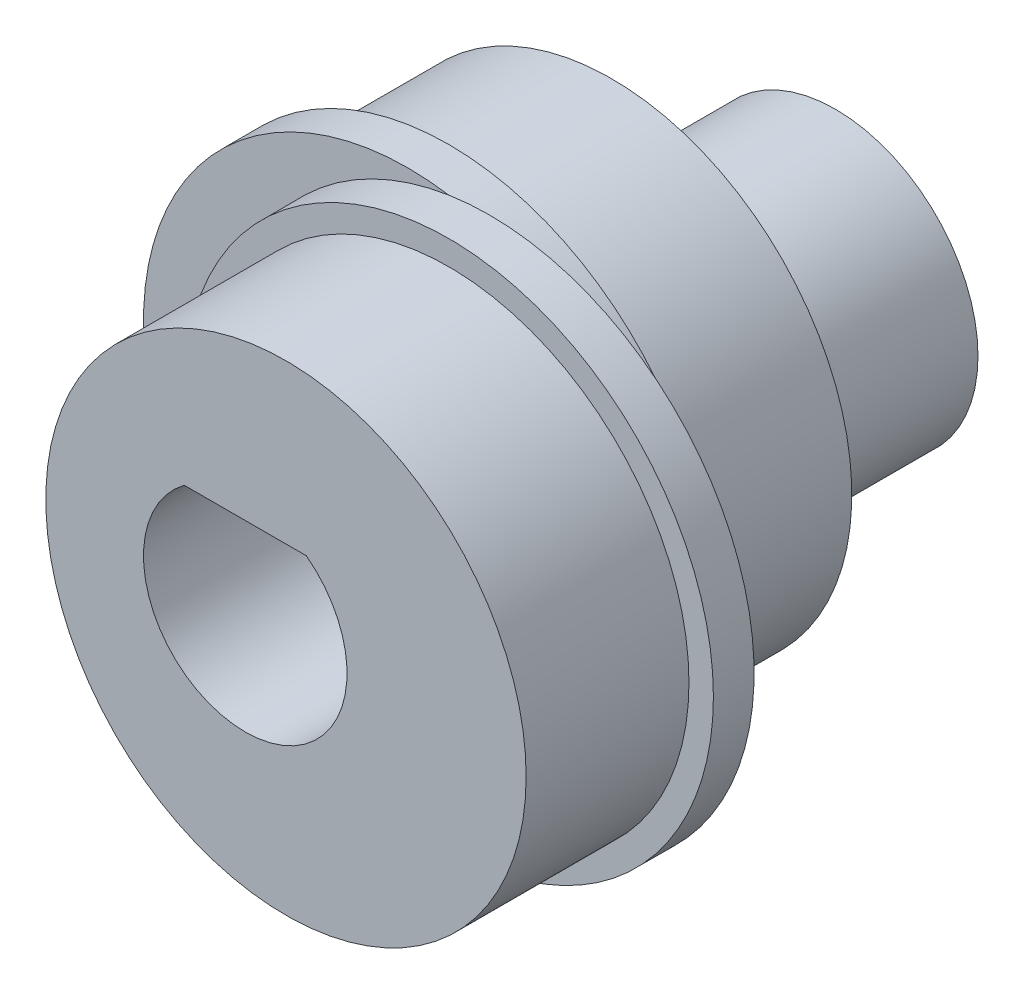
from build123d import *

# Parameters (mm, degrees)
SKETCH1_R           = 3.5
BOSS_EXTRUDE1_DEPTH = 10
SKETCH2_R           = 5.9
SKETCH2_R_2         = 3.5
BOSS_EXTRUDE2_DEPTH = 4
SKETCH3_R           = 6.5
BOSS_EXTRUDE3_DEPTH = 1
SKETCH4_R           = 6.5
BOSS_EXTRUDE4_DEPTH = 1
SKETCH5_R           = 5.9
BOSS_EXTRUDE5_DEPTH = 4
BOSS_EXTRUDE6_START = -4.5
SKETCH1_2_R         = 3.5
BOSS_EXTRUDE6_DEPTH = 4.5


with BuildPart() as part:
    # Sketch1 → Boss-Extrude1 (new body)
    with BuildSketch(Plane.XY):
        Circle(SKETCH1_R)
        with BuildLine():
            Line((-1.5, 2), (1.5, 2))
            ThreePointArc((1.5, 2), (0, -2.5), (-1.5, 2))
        make_face(mode=Mode.SUBTRACT)
    extrude(amount=BOSS_EXTRUDE1_DEPTH)

    # Sketch2 → Boss-Extrude2 (add)
    with BuildSketch(Plane(origin=(0, 0, 0), x_dir=(-1, 0, 0), z_dir=(0, 0, -1))):
        with Locations((1, 0)):
            Circle(SKETCH2_R)
        Circle(SKETCH2_R_2, mode=Mode.SUBTRACT)
    extrude(amount=-BOSS_EXTRUDE2_DEPTH)

    # Sketch3 → Boss-Extrude3 (add)
    with BuildSketch(Plane.XY.offset(4)):
        with Locations((-1, 0)):
            Circle(SKETCH3_R)
        with BuildLine():
            Line((1.5, 2), (-1.5, 2))
            ThreePointArc((-1.5, 2), (0, -2.5), (1.5, 2))
        make_face(mode=Mode.SUBTRACT)
    extrude(amount=BOSS_EXTRUDE3_DEPTH)

    # Sketch4 → Boss-Extrude4 (add)
    with BuildSketch(Plane.XY.offset(5)):
        with Locations((1, 0)):
            Circle(SKETCH4_R)
        with BuildLine():
            Line((1.5, 2), (-1.5, 2))
            ThreePointArc((-1.5, 2), (0, -2.5), (1.5, 2))
        make_face(mode=Mode.SUBTRACT)
    extrude(amount=BOSS_EXTRUDE4_DEPTH)

    # Sketch5 → Boss-Extrude5 (add)
    with BuildSketch(Plane.XY.offset(6)):
        with Locations((1, 0)):
            Circle(SKETCH5_R)
        with BuildLine():
            Line((1.5, 2), (-1.5, 2))
            ThreePointArc((-1.5, 2), (0, -2.5), (1.5, 2))
        make_face(mode=Mode.SUBTRACT)
    extrude(amount=BOSS_EXTRUDE5_DEPTH)

    # Sketch1<2> → Boss-Extrude6 (add)
    with BuildSketch(Plane.XY.offset(BOSS_EXTRUDE6_START)):
        Circle(SKETCH1_2_R)
        with BuildLine():
            Line((-1.5, 2), (1.5, 2))
            ThreePointArc((1.5, 2), (0, -2.5), (-1.5, 2))
        make_face(mode=Mode.SUBTRACT)
    extrude(amount=BOSS_EXTRUDE6_DEPTH)


solid = part.part
